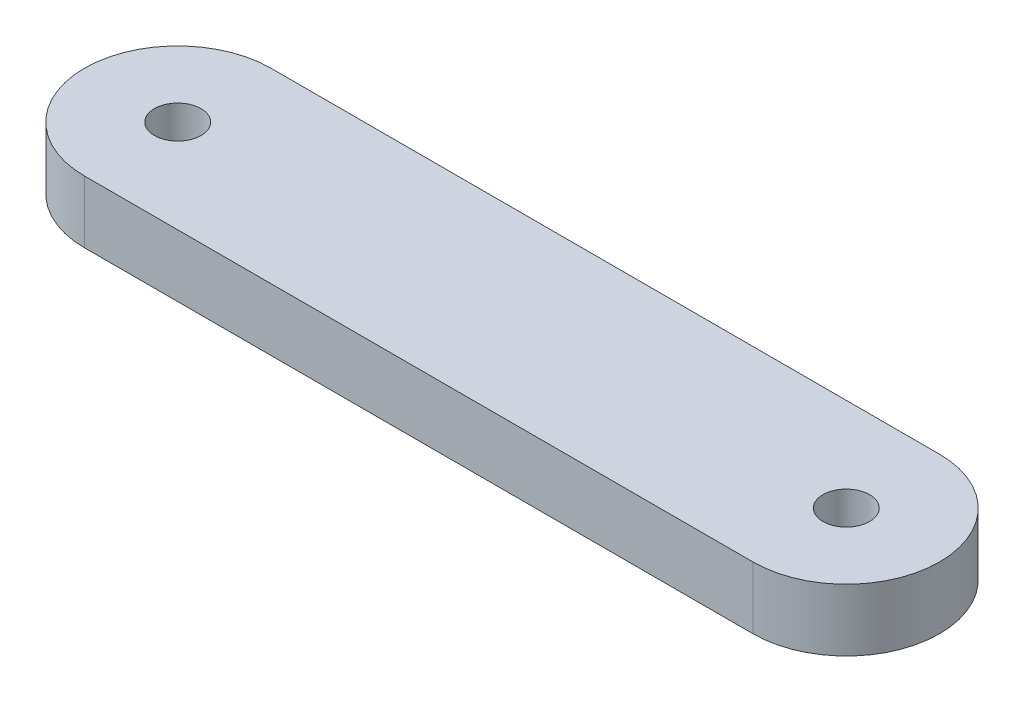
from build123d import *

# Parameters (mm, degrees)
SKETCH1_R           = 1.5
BOSS_EXTRUDE1_DEPTH = 4


with BuildPart() as part:
    # Sketch1 → Boss-Extrude1 (new body)
    with BuildSketch(Plane(origin=(0, 0, 0), x_dir=(1, 0, 0), z_dir=(0, 1, 0))):
        with BuildLine():
            Line((-21.5, 6), (21.5, 6))
            ThreePointArc((21.5, 6), (27.5, 0), (21.5, -6))
            Line((21.5, -6), (-21.5, -6))
            ThreePointArc((-21.5, -6), (-27.5, 0), (-21.5, 6))
        make_face()
        with Locations(Location((-21.5, 0, 0), (0, 0, 270))):
            Circle(SKETCH1_R, mode=Mode.SUBTRACT)
        with Locations(Location((21.5, 0, 0), (0, 0, 270))):
            Circle(SKETCH1_R, mode=Mode.SUBTRACT)
    extrude(amount=BOSS_EXTRUDE1_DEPTH)


solid = part.part
